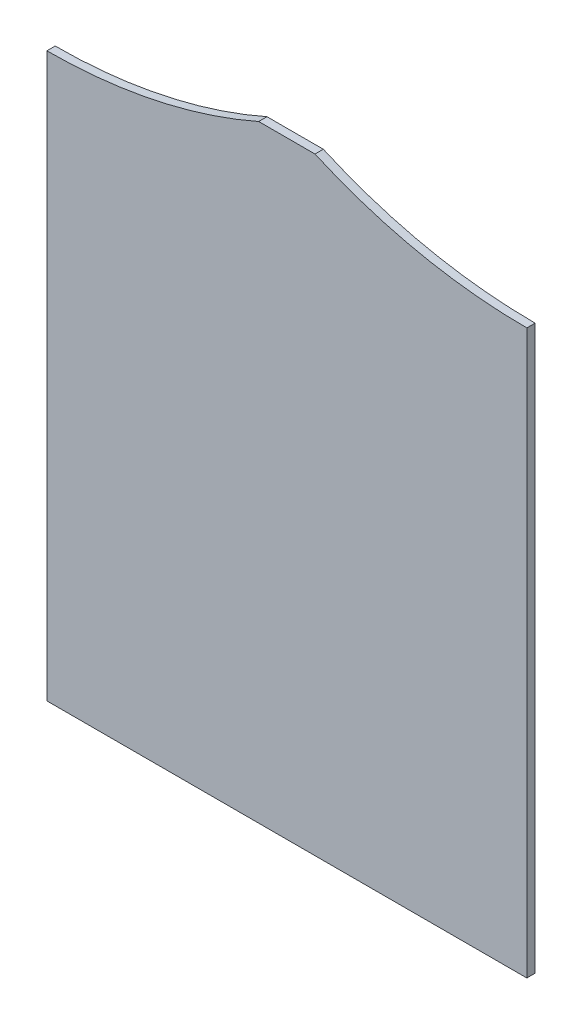
from build123d import *

# Parameters (mm, degrees)
BOSS_EXTRUDE1_DEPTH = 2.95


with BuildPart() as part:
    # Sketch1 → Boss-Extrude1 (new body)
    with BuildSketch(Plane.XY):
        with BuildLine():
            Line((-59.89739229, 103.171587302), (-39.89739229, 103.171587302))
            ThreePointArc((-39.89739229, 103.171587302), (-3.10002354, 91.312248832), (35.35260771, 87.301587302))
            Line((35.35260771, 87.301587302), (35.35260771, -112.698412698))
            Line((35.35260771, -112.698412698), (-135.14739229, -112.698412698))
            Line((-135.14739229, -112.698412698), (-135.14739229, 87.301587302))
            ThreePointArc((-135.14739229, 87.301587302), (-96.694761041, 91.312248832), (-59.89739229, 103.171587302))
        make_face()
    extrude(amount=BOSS_EXTRUDE1_DEPTH)


solid = part.part
